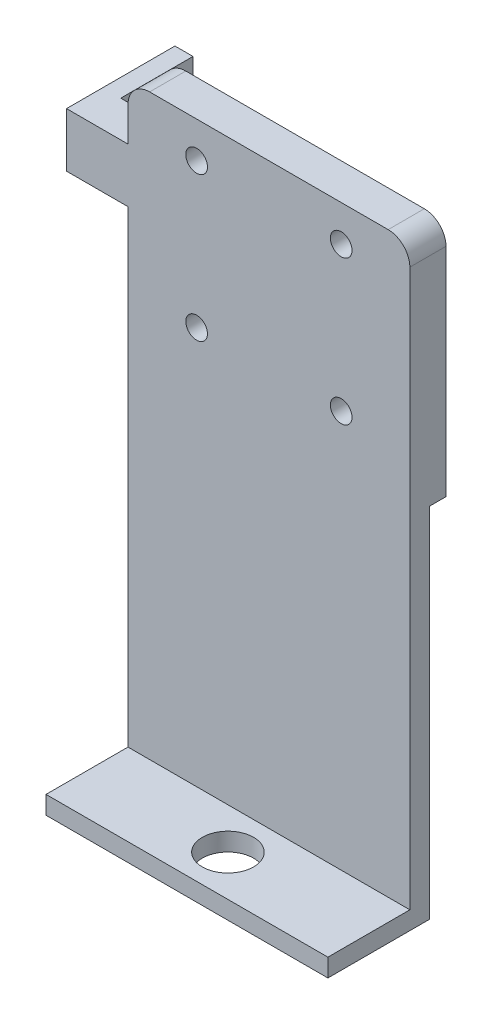
from build123d import *

# Parameters (mm, degrees)
CROQUIS1_R              = 3
SALIENTE_EXTRUIR1_DEPTH = 10
REDONDEO3_R             = 6
REDONDEO4_R             = 6
CROQUIS3_W              = 78
CROQUIS3_H              = 99
SALIENTE_EXTRUIR2_DEPTH = 5.5
CROQUIS4_W              = 78
CROQUIS4_H              = 22.679982155
SALIENTE_EXTRUIR3_DEPTH = 5
CROQUIS6_R              = 7.1
CORTAR_EXTRUIR1_DEPTH   = 40
CROQUIS7_W              = 20
CROQUIS7_H              = 15
SALIENTE_EXTRUIR4_DEPTH = 5


with BuildPart() as part:
    # Croquis1 → Saliente-Extruir1 (new body)
    with BuildSketch(Plane.XY):
        Polygon((0, 0), (78, 0), (78, -66), (0, -66), (0, -30.5), (-10, -30.5), (-17, -30.5), (-17, -15.5), (0, -15.5), align=None)
        with Locations((19, -10)):
            Circle(CROQUIS1_R, mode=Mode.SUBTRACT)
        with Locations((19, -50)):
            Circle(CROQUIS1_R, mode=Mode.SUBTRACT)
        with Locations(Location((59, -50, 0), (0, 0, 180))):
            Circle(CROQUIS1_R, mode=Mode.SUBTRACT)
        with Locations(Location((59, -10, 0), (0, 0, 180))):
            Circle(CROQUIS1_R, mode=Mode.SUBTRACT)
    extrude(amount=SALIENTE_EXTRUIR1_DEPTH)

    # Redondeo3
    redondeo3_edges = [part.edges().sort_by_distance(p)[0] for p in [
        (0, 0, 5),
    ]]
    fillet(redondeo3_edges, radius=REDONDEO3_R)

    # Redondeo4
    redondeo4_edges = [part.edges().sort_by_distance(p)[0] for p in [
        (78, 0, 5),
    ]]
    fillet(redondeo4_edges, radius=REDONDEO4_R)

    # Croquis3 → Saliente-Extruir2 (add)
    with BuildSketch(Plane.XY.offset(10)):
        with Locations((39, -115.5)):
            Rectangle(CROQUIS3_W, CROQUIS3_H)
    extrude(amount=-SALIENTE_EXTRUIR2_DEPTH)

    # Croquis4 → Saliente-Extruir3 (add)
    with BuildSketch(Plane.XZ.offset(165)):
        with Locations((39, 21.339991078)):
            Rectangle(CROQUIS4_W, CROQUIS4_H)
    extrude(amount=-SALIENTE_EXTRUIR3_DEPTH)

    # Croquis6 → Cortar-Extruir1 (cut)
    with BuildSketch(Plane(origin=(0, -160, 0), x_dir=(1, 0, 0), z_dir=(0, 1, 0))):
        with Locations(Location((39, -21.339991078, 0), (0, 0, 270))):
            Circle(CROQUIS6_R)
    extrude(amount=-CORTAR_EXTRUIR1_DEPTH, mode=Mode.SUBTRACT)

    # Croquis7 → Saliente-Extruir4 (add)
    with BuildSketch(Plane.ZY.offset(17)):
        with Locations((-10, -23)):
            Rectangle(CROQUIS7_W, CROQUIS7_H)
    extrude(amount=-SALIENTE_EXTRUIR4_DEPTH)


solid = part.part
